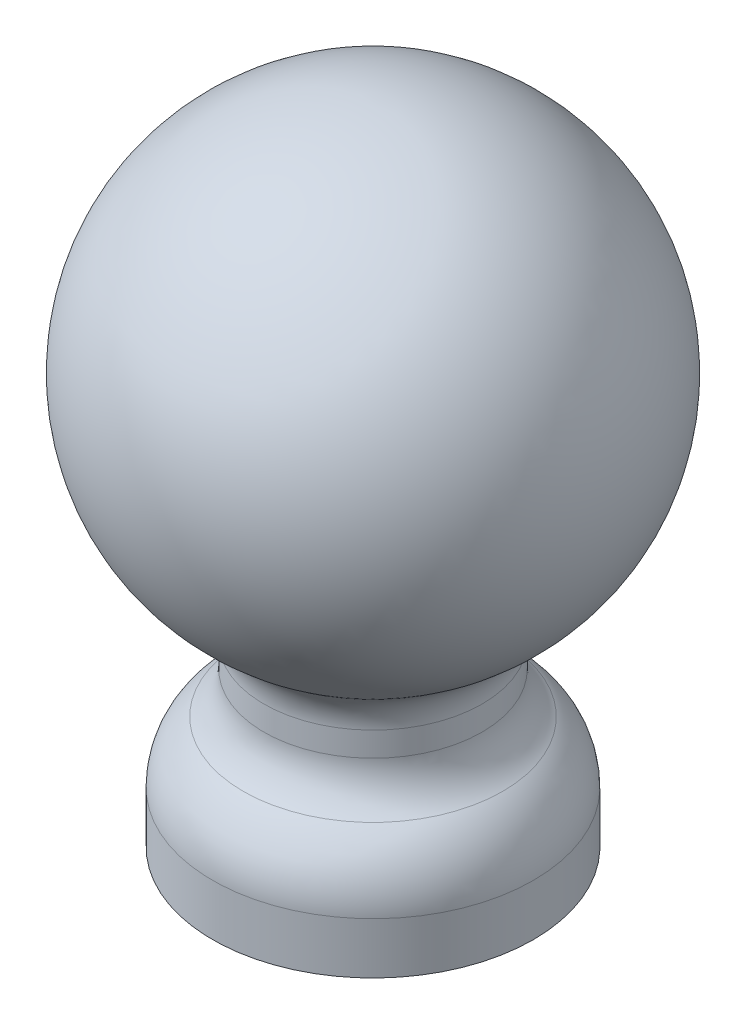
from build123d import *

# Parameters (mm, degrees)
ZAOKR_GLENIE1_R            = 6
OTW_R_GWINTOWANY_M51_D     = 4.2
OTW_R_GWINTOWANY_M51_DEPTH = 14
OTW_R_GWINTOWANY_M51_TIP   = 1.2618073


with BuildPart() as part:
    # Szkic1 → Obrót1 (revolve)
    with BuildSketch(Plane.XY):
        with BuildLine():
            Line((0, 0), (12.5, 0))
            Line((12.5, 0), (12.5, 8))
            ThreePointArc((12.5, 8), (9.671572875, 9.171572875), (8.5, 12))
            Line((8.5, 12), (8.5, 13.89613301))
            ThreePointArc((8.5, 13.89613301), (8.958043684, 15.754773764), (10.227272727, 17.18774519))
            ThreePointArc((10.227272727, 17.18774519), (17.18459465, 37.356277318), (0, 50))
            Line((0, 50), (0, 0))
        make_face()
    revolve(axis=Axis((0, 0, 0), (0, 1, 0)))

    # Zaokrąglenie1
    zaokr_glenie1_edges = [part.edges().sort_by_distance(p)[0] for p in [
        (-12.5, 8, 0),
    ]]
    fillet(zaokr_glenie1_edges, radius=ZAOKR_GLENIE1_R)

    # Otwór gwintowany M51
    with Locations(Plane(origin=(0, 0, 0), x_dir=(-1, 0, 0), z_dir=(0, -1, 0))):
        with Locations((0, 0)):
            Hole(OTW_R_GWINTOWANY_M51_D / 2, depth=OTW_R_GWINTOWANY_M51_DEPTH)
            with Locations((0, 0, -(OTW_R_GWINTOWANY_M51_DEPTH + OTW_R_GWINTOWANY_M51_TIP / 2))):  # 118° drill point
                Cone(0, OTW_R_GWINTOWANY_M51_D / 2, OTW_R_GWINTOWANY_M51_TIP, mode=Mode.SUBTRACT)


solid = part.part
